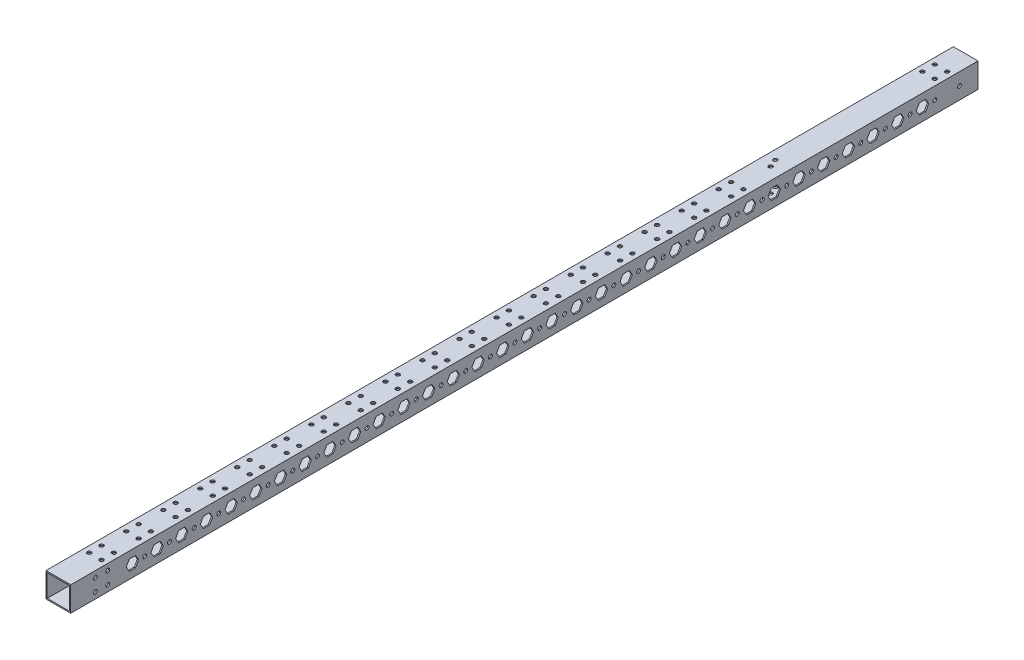
from build123d import *

# Parameters (mm, degrees)
SKETCH_1_W          = 20
SKETCH_1_H          = 20
SKETCH_1_W_2        = 18
SKETCH_1_H_2        = 18
EXTRUDE_1_DEPTH     = 735
SKETCH_2_R          = 1.575
CUT_EXTRUDE_1_DEPTH = 736.544016358
SKETCH_3_R          = 1.6
SKETCH_3_R_2        = 1.575
CUT_EXTRUDE_2_DEPTH = 736.544016358


with BuildPart() as part:
    # 草图1 → 拉伸-薄壁1 (new body)
    with BuildSketch(Plane.XY):
        with Locations((10, -10)):
            Rectangle(SKETCH_1_W, SKETCH_1_H)
        with Locations((10, -10)):
            Rectangle(SKETCH_1_W_2, SKETCH_1_H_2, mode=Mode.SUBTRACT)
    extrude(amount=EXTRUDE_1_DEPTH)

    # 草图2 → 切除-拉伸1 (cut, through all)
    with BuildSketch(Plane(origin=(20, 0, 0), x_dir=(0, 0, -1), z_dir=(1, 0, 0))):
        with Locations((-715, -5)):
            Circle(SKETCH_2_R)
        with Locations(Location((-705, -5, 0), (0, 0, 180))):
            Circle(SKETCH_2_R)
        with Locations((-705, -15)):
            Circle(SKETCH_2_R)
        with Locations(Location((-715, -15, 0), (0, 0, 180))):
            Circle(SKETCH_2_R)
        with Locations((-55, -10)):
            Circle(SKETCH_2_R)
        with Locations((-75, -10)):
            Circle(SKETCH_2_R)
        with Locations((-95, -10)):
            Circle(SKETCH_2_R)
        with Locations((-115, -10)):
            Circle(SKETCH_2_R)
        with Locations((-135, -10)):
            Circle(SKETCH_2_R)
        with Locations((-155, -10)):
            Circle(SKETCH_2_R)
        with Locations((-175, -10)):
            Circle(SKETCH_2_R)
        with Locations((-195, -10)):
            Circle(SKETCH_2_R)
        with Locations((-215, -10)):
            Circle(SKETCH_2_R)
        with Locations((-235, -10)):
            Circle(SKETCH_2_R)
        with Locations((-255, -10)):
            Circle(SKETCH_2_R)
        with Locations((-275, -10)):
            Circle(SKETCH_2_R)
        with Locations((-295, -10)):
            Circle(SKETCH_2_R)
        with Locations((-315, -10)):
            Circle(SKETCH_2_R)
        with Locations((-335, -10)):
            Circle(SKETCH_2_R)
        with Locations((-355, -10)):
            Circle(SKETCH_2_R)
        with Locations((-375, -10)):
            Circle(SKETCH_2_R)
        with Locations((-395, -10)):
            Circle(SKETCH_2_R)
        with Locations((-415, -10)):
            Circle(SKETCH_2_R)
        with Locations((-435, -10)):
            Circle(SKETCH_2_R)
        with Locations((-455, -10)):
            Circle(SKETCH_2_R)
        with Locations((-475, -10)):
            Circle(SKETCH_2_R)
        with Locations((-495, -10)):
            Circle(SKETCH_2_R)
        with Locations((-515, -10)):
            Circle(SKETCH_2_R)
        with Locations((-35, -10)):
            Circle(SKETCH_2_R)
        with Locations((-535, -10)):
            Circle(SKETCH_2_R)
        with Locations((-555, -10)):
            Circle(SKETCH_2_R)
        with Locations((-575, -10)):
            Circle(SKETCH_2_R)
        with Locations((-595, -10)):
            Circle(SKETCH_2_R)
        with Locations((-615, -10)):
            Circle(SKETCH_2_R)
        with Locations((-635, -10)):
            Circle(SKETCH_2_R)
        with Locations((-655, -10)):
            Circle(SKETCH_2_R)
        with Locations((-675, -10)):
            Circle(SKETCH_2_R)
        with Locations((-15, -10)):
            Circle(SKETCH_2_R)
        Polygon((-47.5, -5.669872981), (-50, -10), (-47.5, -14.330127019), (-42.5, -14.330127019), (-40, -10), (-42.5, -5.669872981), align=None)
        Polygon((-62.5, -5.669872981), (-67.5, -5.669872981), (-70, -10), (-67.5, -14.330127019), (-62.5, -14.330127019), (-60, -10), align=None)
        Polygon((-82.5, -5.669872981), (-87.5, -5.669872981), (-90, -10), (-87.5, -14.330127019), (-82.5, -14.330127019), (-80, -10), align=None)
        Polygon((-102.5, -5.669872981), (-107.5, -5.669872981), (-110, -10), (-107.5, -14.330127019), (-102.5, -14.330127019), (-100, -10), align=None)
        Polygon((-122.5, -5.669872981), (-127.5, -5.669872981), (-130, -10), (-127.5, -14.330127019), (-122.5, -14.330127019), (-120, -10), align=None)
        Polygon((-142.5, -5.669872981), (-147.5, -5.669872981), (-150, -10), (-147.5, -14.330127019), (-142.5, -14.330127019), (-140, -10), align=None)
        Polygon((-162.5, -5.669872981), (-167.5, -5.669872981), (-170, -10), (-167.5, -14.330127019), (-162.5, -14.330127019), (-160, -10), align=None)
        Polygon((-182.5, -5.669872981), (-187.5, -5.669872981), (-190, -10), (-187.5, -14.330127019), (-182.5, -14.330127019), (-180, -10), align=None)
        Polygon((-202.5, -5.669872981), (-207.5, -5.669872981), (-210, -10), (-207.5, -14.330127019), (-202.5, -14.330127019), (-200, -10), align=None)
        Polygon((-222.5, -5.669872981), (-227.5, -5.669872981), (-230, -10), (-227.5, -14.330127019), (-222.5, -14.330127019), (-220, -10), align=None)
        Polygon((-242.5, -5.669872981), (-247.5, -5.669872981), (-250, -10), (-247.5, -14.330127019), (-242.5, -14.330127019), (-240, -10), align=None)
        Polygon((-262.5, -5.669872981), (-267.5, -5.669872981), (-270, -10), (-267.5, -14.330127019), (-262.5, -14.330127019), (-260, -10), align=None)
        Polygon((-282.5, -5.669872981), (-287.5, -5.669872981), (-290, -10), (-287.5, -14.330127019), (-282.5, -14.330127019), (-280, -10), align=None)
        Polygon((-302.5, -5.669872981), (-307.5, -5.669872981), (-310, -10), (-307.5, -14.330127019), (-302.5, -14.330127019), (-300, -10), align=None)
        Polygon((-322.5, -5.669872981), (-327.5, -5.669872981), (-330, -10), (-327.5, -14.330127019), (-322.5, -14.330127019), (-320, -10), align=None)
        Polygon((-342.5, -5.669872981), (-347.5, -5.669872981), (-350, -10), (-347.5, -14.330127019), (-342.5, -14.330127019), (-340, -10), align=None)
        Polygon((-362.5, -5.669872981), (-367.5, -5.669872981), (-370, -10), (-367.5, -14.330127019), (-362.5, -14.330127019), (-360, -10), align=None)
        Polygon((-382.5, -5.669872981), (-387.5, -5.669872981), (-390, -10), (-387.5, -14.330127019), (-382.5, -14.330127019), (-380, -10), align=None)
        Polygon((-402.5, -5.669872981), (-407.5, -5.669872981), (-410, -10), (-407.5, -14.330127019), (-402.5, -14.330127019), (-400, -10), align=None)
        Polygon((-422.5, -5.669872981), (-427.5, -5.669872981), (-430, -10), (-427.5, -14.330127019), (-422.5, -14.330127019), (-420, -10), align=None)
        Polygon((-442.5, -5.669872981), (-447.5, -5.669872981), (-450, -10), (-447.5, -14.330127019), (-442.5, -14.330127019), (-440, -10), align=None)
        Polygon((-462.5, -5.669872981), (-467.5, -5.669872981), (-470, -10), (-467.5, -14.330127019), (-462.5, -14.330127019), (-460, -10), align=None)
        Polygon((-482.5, -5.669872981), (-487.5, -5.669872981), (-490, -10), (-487.5, -14.330127019), (-482.5, -14.330127019), (-480, -10), align=None)
        Polygon((-502.5, -5.669872981), (-507.5, -5.669872981), (-510, -10), (-507.5, -14.330127019), (-502.5, -14.330127019), (-500, -10), align=None)
        Polygon((-522.5, -5.669872981), (-527.5, -5.669872981), (-530, -10), (-527.5, -14.330127019), (-522.5, -14.330127019), (-520, -10), align=None)
        Polygon((-542.5, -5.669872981), (-547.5, -5.669872981), (-550, -10), (-547.5, -14.330127019), (-542.5, -14.330127019), (-540, -10), align=None)
        Polygon((-562.5, -5.669872981), (-567.5, -5.669872981), (-570, -10), (-567.5, -14.330127019), (-562.5, -14.330127019), (-560, -10), align=None)
        Polygon((-582.5, -5.669872981), (-587.5, -5.669872981), (-590, -10), (-587.5, -14.330127019), (-582.5, -14.330127019), (-580, -10), align=None)
        Polygon((-602.5, -5.669872981), (-607.5, -5.669872981), (-610, -10), (-607.5, -14.330127019), (-602.5, -14.330127019), (-600, -10), align=None)
        Polygon((-622.5, -5.669872981), (-627.5, -5.669872981), (-630, -10), (-627.5, -14.330127019), (-622.5, -14.330127019), (-620, -10), align=None)
        Polygon((-642.5, -5.669872981), (-647.5, -5.669872981), (-650, -10), (-647.5, -14.330127019), (-642.5, -14.330127019), (-640, -10), align=None)
        Polygon((-662.5, -5.669872981), (-667.5, -5.669872981), (-670, -10), (-667.5, -14.330127019), (-662.5, -14.330127019), (-660, -10), align=None)
        Polygon((-682.5, -5.669872981), (-687.5, -5.669872981), (-690, -10), (-687.5, -14.330127019), (-682.5, -14.330127019), (-680, -10), align=None)
    extrude(amount=-CUT_EXTRUDE_1_DEPTH, mode=Mode.SUBTRACT)

    # 草图3 → 切除-拉伸2 (cut, through all)
    with BuildSketch(Plane(origin=(0, 0, 0), x_dir=(1, 0, 0), z_dir=(0, 1, 0))):
        with Locations(Location((5, -405, 0), (0, 0, 270))):
            Circle(SKETCH_3_R)
        with Locations(Location((15, -405, 0), (0, 0, 90))):
            Circle(SKETCH_3_R)
        with Locations(Location((15, -395, 0), (0, 0, 270))):
            Circle(SKETCH_3_R)
        with Locations(Location((5, -395, 0), (0, 0, 90))):
            Circle(SKETCH_3_R)
        with Locations(Location((5, -30, 0), (0, 0, 270))):
            Circle(SKETCH_3_R)
        with Locations(Location((15, -30, 0), (0, 0, 90))):
            Circle(SKETCH_3_R)
        with Locations(Location((15, -20, 0), (0, 0, 270))):
            Circle(SKETCH_3_R)
        with Locations(Location((5, -20, 0), (0, 0, 90))):
            Circle(SKETCH_3_R)
        with Locations(Location((10, -158, 0), (0, 0, 270))):
            Circle(SKETCH_3_R)
        with Locations(Location((7.307692308, -151.538461538, 0), (0, 0, 270))):
            Circle(SKETCH_3_R_2)
        with Locations(Location((5, -425, 0), (0, 0, 90))):
            Circle(SKETCH_3_R)
        with Locations(Location((15, -425, 0), (0, 0, 270))):
            Circle(SKETCH_3_R)
        with Locations(Location((15, -435, 0), (0, 0, 90))):
            Circle(SKETCH_3_R)
        with Locations(Location((5, -435, 0), (0, 0, 270))):
            Circle(SKETCH_3_R)
        with Locations(Location((5, -455, 0), (0, 0, 90))):
            Circle(SKETCH_3_R)
        with Locations(Location((15, -455, 0), (0, 0, 270))):
            Circle(SKETCH_3_R)
        with Locations(Location((15, -465, 0), (0, 0, 90))):
            Circle(SKETCH_3_R)
        with Locations(Location((5, -465, 0), (0, 0, 270))):
            Circle(SKETCH_3_R)
        with Locations(Location((5, -485, 0), (0, 0, 90))):
            Circle(SKETCH_3_R)
        with Locations(Location((15, -485, 0), (0, 0, 270))):
            Circle(SKETCH_3_R)
        with Locations(Location((15, -495, 0), (0, 0, 90))):
            Circle(SKETCH_3_R)
        with Locations(Location((5, -495, 0), (0, 0, 270))):
            Circle(SKETCH_3_R)
        with Locations(Location((5, -515, 0), (0, 0, 90))):
            Circle(SKETCH_3_R)
        with Locations(Location((15, -515, 0), (0, 0, 270))):
            Circle(SKETCH_3_R)
        with Locations(Location((15, -525, 0), (0, 0, 90))):
            Circle(SKETCH_3_R)
        with Locations(Location((5, -525, 0), (0, 0, 270))):
            Circle(SKETCH_3_R)
        with Locations(Location((5, -545, 0), (0, 0, 90))):
            Circle(SKETCH_3_R)
        with Locations(Location((15, -545, 0), (0, 0, 270))):
            Circle(SKETCH_3_R)
        with Locations(Location((15, -555, 0), (0, 0, 90))):
            Circle(SKETCH_3_R)
        with Locations(Location((5, -555, 0), (0, 0, 270))):
            Circle(SKETCH_3_R)
        with Locations(Location((5, -575, 0), (0, 0, 90))):
            Circle(SKETCH_3_R)
        with Locations(Location((15, -575, 0), (0, 0, 270))):
            Circle(SKETCH_3_R)
        with Locations(Location((15, -585, 0), (0, 0, 90))):
            Circle(SKETCH_3_R)
        with Locations(Location((5, -585, 0), (0, 0, 270))):
            Circle(SKETCH_3_R)
        with Locations(Location((5, -605, 0), (0, 0, 90))):
            Circle(SKETCH_3_R)
        with Locations(Location((15, -605, 0), (0, 0, 270))):
            Circle(SKETCH_3_R)
        with Locations(Location((15, -615, 0), (0, 0, 90))):
            Circle(SKETCH_3_R)
        with Locations(Location((5, -615, 0), (0, 0, 270))):
            Circle(SKETCH_3_R)
        with Locations(Location((5, -635, 0), (0, 0, 90))):
            Circle(SKETCH_3_R)
        with Locations(Location((15, -635, 0), (0, 0, 270))):
            Circle(SKETCH_3_R)
        with Locations(Location((15, -645, 0), (0, 0, 90))):
            Circle(SKETCH_3_R)
        with Locations(Location((5, -645, 0), (0, 0, 270))):
            Circle(SKETCH_3_R)
        with Locations(Location((5, -665, 0), (0, 0, 90))):
            Circle(SKETCH_3_R)
        with Locations(Location((15, -665, 0), (0, 0, 270))):
            Circle(SKETCH_3_R)
        with Locations(Location((15, -675, 0), (0, 0, 90))):
            Circle(SKETCH_3_R)
        with Locations(Location((5, -675, 0), (0, 0, 270))):
            Circle(SKETCH_3_R)
        with Locations(Location((5, -695, 0), (0, 0, 90))):
            Circle(SKETCH_3_R)
        with Locations(Location((15, -695, 0), (0, 0, 270))):
            Circle(SKETCH_3_R)
        with Locations(Location((15, -705, 0), (0, 0, 90))):
            Circle(SKETCH_3_R)
        with Locations(Location((5, -705, 0), (0, 0, 270))):
            Circle(SKETCH_3_R)
        with Locations(Location((5, -185, 0), (0, 0, 90))):
            Circle(SKETCH_3_R)
        with Locations(Location((15, -185, 0), (0, 0, 270))):
            Circle(SKETCH_3_R)
        with Locations(Location((15, -195, 0), (0, 0, 90))):
            Circle(SKETCH_3_R)
        with Locations(Location((5, -195, 0), (0, 0, 270))):
            Circle(SKETCH_3_R)
        with Locations(Location((5, -215, 0), (0, 0, 90))):
            Circle(SKETCH_3_R)
        with Locations(Location((15, -215, 0), (0, 0, 270))):
            Circle(SKETCH_3_R)
        with Locations(Location((15, -225, 0), (0, 0, 90))):
            Circle(SKETCH_3_R)
        with Locations(Location((5, -225, 0), (0, 0, 270))):
            Circle(SKETCH_3_R)
        with Locations(Location((5, -245, 0), (0, 0, 90))):
            Circle(SKETCH_3_R)
        with Locations(Location((15, -245, 0), (0, 0, 270))):
            Circle(SKETCH_3_R)
        with Locations(Location((15, -255, 0), (0, 0, 90))):
            Circle(SKETCH_3_R)
        with Locations(Location((5, -255, 0), (0, 0, 270))):
            Circle(SKETCH_3_R)
        with Locations(Location((5, -275, 0), (0, 0, 90))):
            Circle(SKETCH_3_R)
        with Locations(Location((15, -275, 0), (0, 0, 270))):
            Circle(SKETCH_3_R)
        with Locations(Location((15, -285, 0), (0, 0, 90))):
            Circle(SKETCH_3_R)
        with Locations(Location((5, -285, 0), (0, 0, 270))):
            Circle(SKETCH_3_R)
        with Locations(Location((5, -305, 0), (0, 0, 90))):
            Circle(SKETCH_3_R)
        with Locations(Location((15, -305, 0), (0, 0, 270))):
            Circle(SKETCH_3_R)
        with Locations(Location((15, -315, 0), (0, 0, 90))):
            Circle(SKETCH_3_R)
        with Locations(Location((5, -315, 0), (0, 0, 270))):
            Circle(SKETCH_3_R)
        with Locations(Location((5, -335, 0), (0, 0, 90))):
            Circle(SKETCH_3_R)
        with Locations(Location((15, -335, 0), (0, 0, 270))):
            Circle(SKETCH_3_R)
        with Locations(Location((15, -345, 0), (0, 0, 90))):
            Circle(SKETCH_3_R)
        with Locations(Location((5, -345, 0), (0, 0, 270))):
            Circle(SKETCH_3_R)
        with Locations(Location((5, -365, 0), (0, 0, 90))):
            Circle(SKETCH_3_R)
        with Locations(Location((15, -365, 0), (0, 0, 270))):
            Circle(SKETCH_3_R)
        with Locations(Location((15, -375, 0), (0, 0, 90))):
            Circle(SKETCH_3_R)
        with Locations(Location((5, -375, 0), (0, 0, 270))):
            Circle(SKETCH_3_R)
    extrude(amount=-CUT_EXTRUDE_2_DEPTH, mode=Mode.SUBTRACT)


solid = part.part
